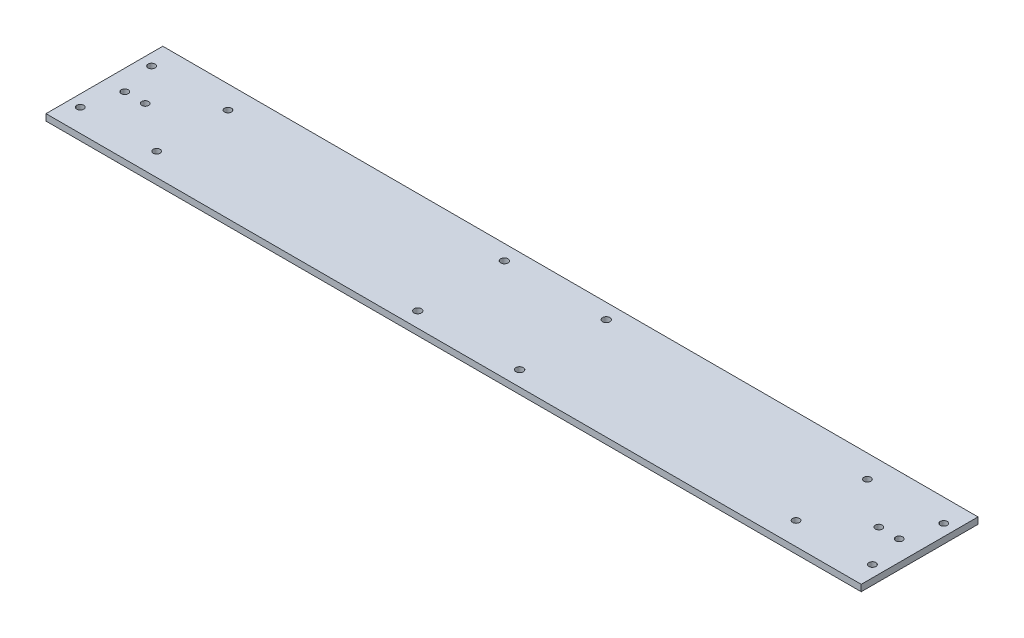
from build123d import *

# Parameters (mm, degrees)
SKETCH1_W                = 400
SKETCH1_H                = 57.3
BOSS_EXTRUDE1_DEPTH      = 3.175
SKETCH2_R                = 1.7
CUT_EXTRUDE1_DEPTH       = 203.066580921
M3_CLEARANCE_HOLE1_D     = 3.6
M3_CLEARANCE_HOLE1_DEPTH = 3.918450886
M3_CLEARANCE_HOLE1_TIP   = 1.081549114


with BuildPart() as part:
    # Sketch1 → Boss-Extrude1 (new body)
    with BuildSketch(Plane(origin=(0, 0, 0), x_dir=(1, 0, 0), z_dir=(0, 1, 0))):
        Rectangle(SKETCH1_W, SKETCH1_H)
    extrude(amount=BOSS_EXTRUDE1_DEPTH)

    # Sketch2 → Cut-Extrude1 (cut, through all)
    with BuildSketch(Plane(origin=(0, 3.175, 0), x_dir=(1, 0, 0), z_dir=(0, 1, 0))):
        with Locations(Location((-194.338207547, -17.5, 0), (0, 0, 270))):
            Circle(SKETCH2_R)
        with Locations(Location((-194.338207547, 17.5, 0), (0, 0, 270))):
            Circle(SKETCH2_R)
        with Locations(Location((-190, -4e-09, 0), (0, 0, 270))):
            Circle(SKETCH2_R)
        with Locations(Location((-180, -4e-09, 0), (0, 0, 270))):
            Circle(SKETCH2_R)
        with Locations(Location((-156.861792453, -17.5, 0), (0, 0, 270))):
            Circle(SKETCH2_R)
        with Locations(Location((-156.861792453, 17.5, 0), (0, 0, 270))):
            Circle(SKETCH2_R)
        with Locations(Location((156.861792453, 17.5, 0), (0, 0, 270))):
            Circle(SKETCH2_R)
        with Locations(Location((156.861792453, -17.5, 0), (0, 0, 270))):
            Circle(SKETCH2_R)
        with Locations(Location((194.338207547, -17.5, 0), (0, 0, 270))):
            Circle(SKETCH2_R)
        with Locations(Location((180, 4e-09, 0), (0, 0, 270))):
            Circle(SKETCH2_R)
        with Locations(Location((190, 4e-09, 0), (0, 0, 270))):
            Circle(SKETCH2_R)
        with Locations(Location((194.338207547, 17.5, 0), (0, 0, 270))):
            Circle(SKETCH2_R)
    extrude(amount=-CUT_EXTRUDE1_DEPTH, mode=Mode.SUBTRACT)

    # M3 Clearance Hole1
    with Locations(Plane(origin=(0, 3.175, 0), x_dir=(1, 0, 0), z_dir=(0, 1, 0))):
        with Locations((25, -21.25), (-25, 21.25), (-25, -21.25), (25, 21.25)):
            Hole(M3_CLEARANCE_HOLE1_D / 2, depth=M3_CLEARANCE_HOLE1_DEPTH)
            with Locations((0, 0, -(M3_CLEARANCE_HOLE1_DEPTH + M3_CLEARANCE_HOLE1_TIP / 2))):  # 118° drill point
                Cone(0, M3_CLEARANCE_HOLE1_D / 2, M3_CLEARANCE_HOLE1_TIP, mode=Mode.SUBTRACT)


solid = part.part
